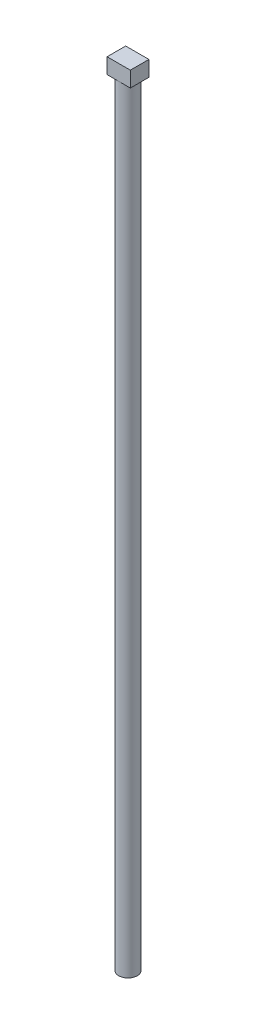
from build123d import *

# Parameters (mm, degrees)
SKETCH_2_R      = 1.2
SKETCH_2_R_2    = 0.7
EXTRUDE_1_DEPTH = 100
SKETCH_3_W      = 3
SKETCH_3_H      = 2.4
EXTRUDE_2_DEPTH = 2


with BuildPart() as part:
    # 草图2 → 凸台-拉伸1 (new body)
    with BuildSketch(Plane(origin=(0, 0, 0), x_dir=(1, 0, 0), z_dir=(0, 1, 0))):
        with Locations(Location((0, 0, 0), (0, 0, 270))):
            Circle(SKETCH_2_R)
        with Locations(Location((0, 0, 0), (0, 0, 270))):
            Circle(SKETCH_2_R_2, mode=Mode.SUBTRACT)
    extrude(amount=EXTRUDE_1_DEPTH)

    # 草图3 → 凸台-拉伸2 (add)
    with BuildSketch(Plane(origin=(0, 100, 0), x_dir=(1, 0, 0), z_dir=(0, 1, 0))):
        Rectangle(SKETCH_3_W, SKETCH_3_H)
    extrude(amount=EXTRUDE_2_DEPTH)


solid = part.part
